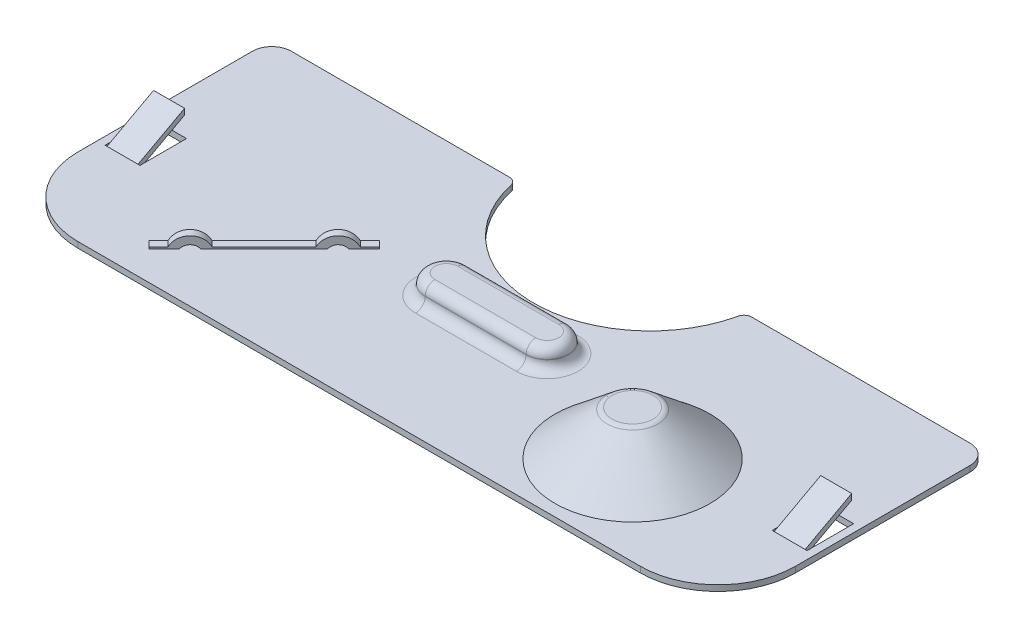
from build123d import *

# Parameters (mm, degrees)
SKETCH1_W               = 37
SKETCH1_H               = 14
BASE_DEPTH              = 0.3
SKETCH3_R               = 6
TOP_SEMI_CIRCLE_DEPTH   = 20.782315335
SKETCH2_R               = 4
PT_CUT_DEPTH            = 20.782315335
MID_SLOT_BOSS_DEPTH     = 1
MID_SLOT_BOSS_TAPER     = 1
MSB_CUT_DEPTH           = 1.1
MSB_CUT_DRAFT           = -1
SKETCH7_W               = 1.8
SKETCH7_H               = 2.4
LOCKING_CLAMP_CUT_DEPTH = 20.91331213
LOCKING_CLAMP_DEPTH     = 0.8
SPRING_CLASP_DEPTH      = 0.2
TS_F_R                  = 1
BS_F_R                  = 4
SC_F_R                  = 0.4
MSB_OUTER_R             = 0.5
MSB_INNER_R             = 0.5


with BuildPart() as part:
    # Sketch1 → BASE (new body)
    with BuildSketch(Plane(origin=(0, 0, 0), x_dir=(1, 0, 0), z_dir=(0, 1, 0))):
        Rectangle(SKETCH1_W, SKETCH1_H)
    extrude(amount=BASE_DEPTH)

    # Sketch3 → TOP SEMI CIRCLE (cut, through all)
    with BuildSketch(Plane(origin=(0, 0.3, 0), x_dir=(1, 0, 0), z_dir=(0, 1, 0))):
        with Locations((0, 8)):
            Circle(SKETCH3_R)
    extrude(amount=-TOP_SEMI_CIRCLE_DEPTH, mode=Mode.SUBTRACT)

    # Sketch2 → PT CUT (cut, through all)
    with BuildSketch(Plane(origin=(0, 0.3, 0), x_dir=(1, 0, 0), z_dir=(0, 1, 0))):
        with Locations(Location((9.5, -2.4, 0), (0, 0, 270))):
            Circle(SKETCH2_R)
    extrude(amount=-PT_CUT_DEPTH, mode=Mode.SUBTRACT)

    # Sketch4 → POSITIVE TERMINAL (revolve)
    with BuildSketch(Plane.XY.offset(2.4), mode=Mode.PRIVATE) as positive_terminal_sk:
        with BuildLine():
            Line((9.5, 2.6), (10.556776663, 2.6))
            ThreePointArc((10.556776663, 2.6), (10.691616938, 2.576587441), (10.810672433, 2.509090502))
            Line((10.810672433, 2.509090502), (13.5, 0.3))
            Line((13.5, 0.3), (13.5, 0))
            Line((13.5, 0), (13.2, 0))
            ThreePointArc((13.2, 0), (13.129289322, 0.029289322), (13.1, 0.1))
            Line((13.1, 0.1), (13.1, 0.252730922))
            ThreePointArc((13.1, 0.252730922), (13.090408501, 0.295466187), (13.063473942, 0.330003547))
            Line((13.063473942, 0.330003547), (10.720553608, 2.254545251))
            ThreePointArc((10.720553608, 2.254545251), (10.66102586, 2.28829372), (10.593605723, 2.3))
            Line((10.593605723, 2.3), (9.5, 2.3))
            Line((9.5, 2.3), (9.5, 2.6))
        make_face()
    revolve(positive_terminal_sk.sketch.rotate(Axis((9.5, 0, 2.4), (0, 1, 0)), 90), axis=Axis((9.5, 0, 2.4), (0, 1, 0)))

    # Sketch5 → MID SLOT BOSS (add)
    with BuildSketch(Plane(origin=(0, 0.3, 0), x_dir=(1, 0, 0), z_dir=(0, 1, 0))):
        with BuildLine():
            ThreePointArc((-2.6, 1.2), (-3.7, 0.1), (-2.6, -1))
            Line((-2.6, -1), (2.6, -1))
            ThreePointArc((2.6, -1), (3.7, 0.1), (2.6, 1.2))
            Line((2.6, 1.2), (-2.6, 1.2))
        make_face()
    extrude(amount=MID_SLOT_BOSS_DEPTH, taper=MID_SLOT_BOSS_TAPER)


with BuildPart() as msb_cut_tool:
    # Sketch6 → MSB CUT (with draft: the straight prism first)
    with BuildSketch(Plane.XZ):
        with BuildLine():
            ThreePointArc((2.6, -1), (3.5, -0.1), (2.6, 0.8))
            Line((2.6, 0.8), (-2.6, 0.8))
            ThreePointArc((-2.6, 0.8), (-3.5, -0.1), (-2.6, -1))
            Line((-2.6, -1), (2.6, -1))
        make_face()
    extrude(amount=-MSB_CUT_DEPTH)
    # MSB CUT: the draft: its side faces are tilted about the plane it starts from
    msb_cut_sides = [msb_cut_tool.faces().sort_by_distance(p)[0] for p in [
        (-3.5, 0.55, -0.1),
        (0, 0.55, -1),
        (3.5, 0.55, -0.1),
        (0, 0.55, 0.8),
    ]]
    draft(msb_cut_sides, Plane.XZ, MSB_CUT_DRAFT)


with BuildPart() as part_1:
    add(part.part)

    # MSB CUT: cut by msb_cut_tool
    add(msb_cut_tool.part, mode=Mode.SUBTRACT)

    # Sketch7 → LOCKING CLAMP CUT (cut, through all)
    with BuildSketch(Plane(origin=(0, 0.3, 0), x_dir=(1, 0, 0), z_dir=(0, 1, 0))):
        with Locations((17.2, -0.8)):
            Rectangle(SKETCH7_W, SKETCH7_H)
    locking_clamp_cut = extrude(amount=-LOCKING_CLAMP_CUT_DEPTH, mode=Mode.SUBTRACT)

    # Sketch9 → LOCKING CLAMP (add, symmetric)
    with BuildSketch(Plane.ZY.offset(-17.2)):
        Polygon((2, 0.3), (-0.4, 1.6), (-0.4, 1.3), (2, 0), align=None)
    locking_clamp = extrude(amount=LOCKING_CLAMP_DEPTH, both=True)

    # LC M: LOCKING CLAMP CUT, LOCKING CLAMP across plane
    add(locking_clamp_cut.mirror(Plane(origin=(0, 0, 0), x_dir=(0, 0, 1), z_dir=(1, 0, 0))), mode=Mode.SUBTRACT)
    add(locking_clamp.mirror(Plane(origin=(0, 0, 0), x_dir=(0, 0, 1), z_dir=(1, 0, 0))))

    # Sketch11 → SPRING CLASP (add, symmetric)
    with BuildSketch(Plane(origin=(-3.55, 0, -3.55), x_dir=(-0.7071067811865459, 0, 0.7071067811865491), z_dir=(-0.7071067811865491, 0, -0.7071067811865459))):
        with BuildLine():
            Line((12.614570696, 0), (11.706178674, 0))
            ThreePointArc((11.706178674, 0), (11.641628952, 0.023623738), (11.607577345, 0.083333333))
            ThreePointArc((11.607577345, 0.083333333), (11.114570696, 0.5), (10.621564048, 0.083333333))
            ThreePointArc((10.621564048, 0.083333333), (10.58751244, 0.023623738), (10.522962718, 0))
            Line((10.522962718, 0), (6.306178674, 0))
            ThreePointArc((6.306178674, 0), (6.241628952, 0.023623738), (6.207577345, 0.083333333))
            ThreePointArc((6.207577345, 0.083333333), (5.714570696, 0.5), (5.221564048, 0.083333333))
            ThreePointArc((5.221564048, 0.083333333), (5.18751244, 0.023623738), (5.122962718, 0))
            Line((5.122962718, 0), (4.214570696, 0))
            Line((4.214570696, 0), (4.214570696, 0.4))
            Line((4.214570696, 0.4), (4.908344921, 0.4))
            ThreePointArc((4.908344921, 0.4), (5.714570696, 0.9), (6.520796471, 0.4))
            Line((6.520796471, 0.4), (10.308344921, 0.4))
            ThreePointArc((10.308344921, 0.4), (11.114570696, 0.9), (11.920796471, 0.4))
            Line((11.920796471, 0.4), (12.614570696, 0.4))
            Line((12.614570696, 0.4), (12.614570696, 0))
        make_face()
    extrude(amount=SPRING_CLASP_DEPTH, both=True)

    # TS F
    ts_f_edges = [part_1.edges().sort_by_distance(p)[0] for p in [
        (-18.5, 0.15, -7),
        (18.5, 0.15, -7),
    ]]
    fillet(ts_f_edges, radius=TS_F_R)

    # BS F
    bs_f_edges = [part_1.edges().sort_by_distance(p)[0] for p in [
        (18.5, 0.15, 7),
        (-18.5, 0.15, 7),
    ]]
    fillet(bs_f_edges, radius=BS_F_R)

    # SC F
    sc_f_edges = [part_1.edges().sort_by_distance(p)[0] for p in [
        (5.916079783, 0.15, -7),
        (-5.916079783, 0.15, -7),
    ]]
    fillet(sc_f_edges, radius=SC_F_R)

    # MSB OUTER
    msb_outer_edges = [part_1.edges().sort_by_distance(p)[0] for p in [
        (-3.7, 0.3, -0.1),
        (0, 0.3, 1),
        (3.7, 0.3, -0.1),
        (0, 0.3, -1.2),
        (-3.682544935, 1.3, -0.1),
        (0, 1.3, 0.982544935),
        (3.682544935, 1.3, -0.1),
        (0, 1.3, -1.182544935),
    ]]
    fillet(msb_outer_edges, radius=MSB_OUTER_R)

    # MSB INNER
    msb_inner_edges = [part_1.edges().sort_by_distance(p)[0] for p in [
        (3.5, 0, -0.1),
        (0, 0, 0.8),
        (-3.5, 0, -0.1),
        (0, 0, -1),
        (0, 1.1, 0.780799429),
        (-3.480799429, 1.1, -0.1),
        (0, 1.1, -0.980799429),
        (3.480799429, 1.1, -0.1),
    ]]
    fillet(msb_inner_edges, radius=MSB_INNER_R)


solid = part_1.part
